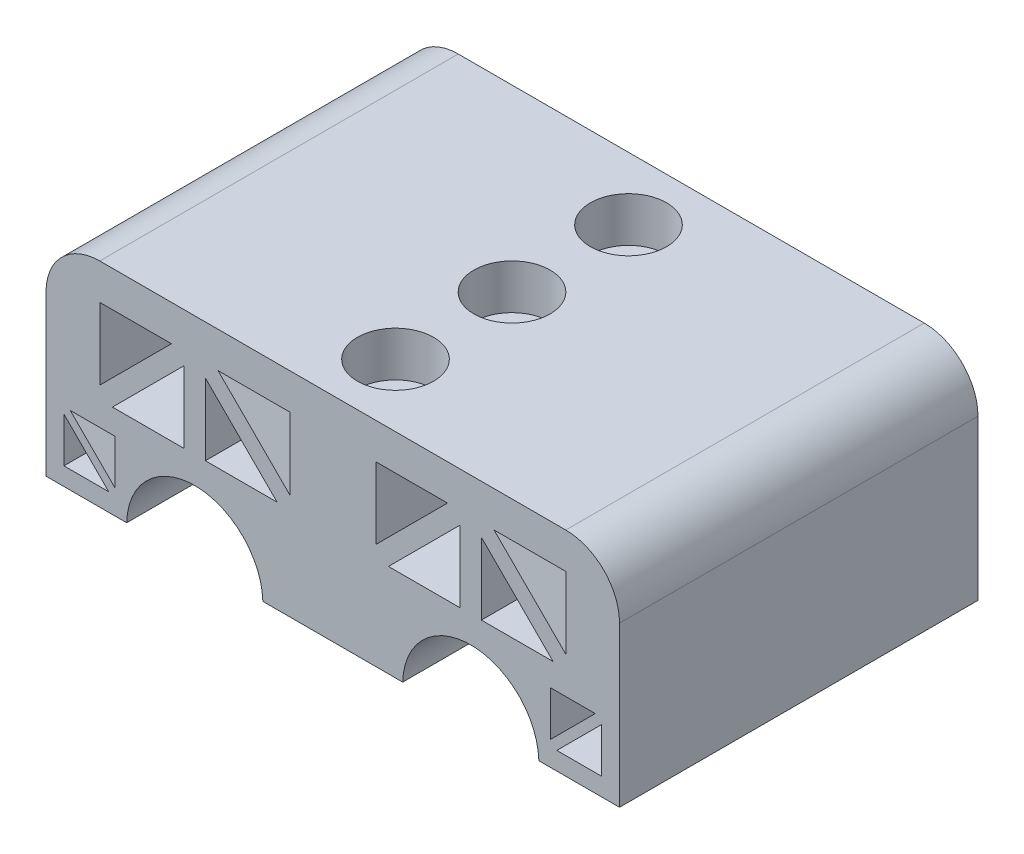
from build123d import *

# Parameters (mm, degrees)
BOSS_EXTRUDE1_DEPTH     = 50.8
SKETCH2_W               = 81.28
SKETCH2_H               = 50.8
CUT_EXTRUDE1_DEPTH      = 0.254
SKETCH3_R               = 5.3975
CUT_EXTRUDE2_DEPTH      = 6.35
CUT_EXTRUDE3_DEPTH      = 99.778245459
CUT_EXTRUDE3_DEPTH_BACK = 99.778245459
SKETCH4_R               = 3.302
CUT_EXTRUDE4_DEPTH      = 101.578868556
FILLET1_R               = 7.62


with BuildPart() as part:
    # Sketch1 → Boss-Extrude1 (new body)
    with BuildSketch(Plane.XY):
        with BuildLine():
            Line((30.734, 0), (40.64, 0))
            Line((40.64, 0), (40.64, 30.48))
            Line((40.64, 30.48), (0, 30.48))
            Line((0, 30.48), (0, 0))
            Line((0, 0), (11.43, 0))
            ThreePointArc((11.43, 0), (21.082, 9.652), (30.734, 0))
        make_face()
        with BuildLine():
            Line((40.64, 30.48), (40.64, 0))
            Line((40.64, 0), (50.546, 0))
            ThreePointArc((50.546, 0), (60.198, 9.652), (69.85, 0))
            Line((69.85, 0), (81.28, 0))
            Line((81.28, 0), (81.28, 30.48))
            Line((81.28, 30.48), (40.64, 30.48))
        make_face()
    extrude(amount=BOSS_EXTRUDE1_DEPTH)

    # Sketch2 → Cut-Extrude1 (cut)
    with BuildSketch(Plane(origin=(0, 0, 0), x_dir=(-1, 0, 0), z_dir=(0, -1, 0))):
        with Locations((-40.64, -25.4)):
            Rectangle(SKETCH2_W, SKETCH2_H)
    extrude(amount=-CUT_EXTRUDE1_DEPTH, mode=Mode.SUBTRACT)

    # Sketch3 → Cut-Extrude2 (cut)
    with BuildSketch(Plane(origin=(0, 30.48, 0), x_dir=(1, 0, 0), z_dir=(0, 1, 0))):
        with Locations(Location((40.64, -8.89, 0), (0, 0, 270))):
            Circle(SKETCH3_R)
        with Locations(Location((40.64, -41.91, 0), (0, 0, 90))):
            Circle(SKETCH3_R)
        with Locations(Location((40.64, -25.4, 0), (0, 0, 270))):
            Circle(SKETCH3_R)
    extrude(amount=-CUT_EXTRUDE2_DEPTH, mode=Mode.SUBTRACT)

    # Sketch4 → Cut-Extrude3 (cut, two sides: drawn at the far end of the back side and taken through both)
    with BuildSketch(Plane(origin=(0, 24.13, 0), x_dir=(1, 0, 0), z_dir=(0, 1, 0)).offset(-CUT_EXTRUDE3_DEPTH_BACK)):
        with Locations(Location((40.64, -8.89, 0), (0, 0, 270))):
            Circle(SKETCH4_R)
        with Locations(Location((40.64, -41.91, 0), (0, 0, 270))):
            Circle(SKETCH4_R)
        with Locations(Location((40.64, -25.4, 0), (0, 0, 270))):
            Circle(SKETCH4_R)
    extrude(amount=CUT_EXTRUDE3_DEPTH + CUT_EXTRUDE3_DEPTH_BACK, mode=Mode.SUBTRACT)

    # Sketch5 → Cut-Extrude4 (cut, through all)
    with BuildSketch(Plane.XY.offset(50.8)):
        Polygon((7.62, 15.24), (7.62, 25.4), (17.78, 25.4), align=None)
        Polygon((19.576051224, 13.443948776), (19.576051224, 23.603948776), (9.416051224, 13.443948776), align=None)
        Polygon((22.587948776, 23.603948776), (32.747948776, 13.443948776), (22.587948776, 13.443948776), align=None)
        Polygon((24.384, 25.4), (34.544, 15.24), (34.544, 25.4), align=None)
        Polygon((46.736, 15.24), (46.736, 25.4), (56.896, 25.4), align=None)
        Polygon((58.692051224, 13.443948776), (58.692051224, 23.603948776), (48.532051224, 13.443948776), align=None)
        Polygon((61.703948776, 23.603948776), (71.863948776, 13.443948776), (61.703948776, 13.443948776), align=None)
        Polygon((63.5, 25.4), (73.66, 15.24), (73.66, 25.4), align=None)
        Polygon((2.541671342, 2.794), (8.891671342, 2.794), (2.541671342, 9.144), align=None)
        Polygon((3.439696954, 10.042025612), (9.789696954, 3.692025612), (9.789696954, 10.042025612), align=None)
        Polygon((71.490303046, 10.042025612), (77.840303046, 10.042025612), (71.490303046, 3.692025612), align=None)
        Polygon((78.738328658, 9.144), (72.388328658, 2.794), (78.738328658, 2.794), align=None)
    extrude(amount=-CUT_EXTRUDE4_DEPTH, mode=Mode.SUBTRACT)

    # Fillet1
    fillet1_edges = [part.edges().sort_by_distance(p)[0] for p in [
        (0, 30.48, 25.4),
        (81.28, 30.48, 25.4),
    ]]
    fillet(fillet1_edges, radius=FILLET1_R)


solid = part.part
